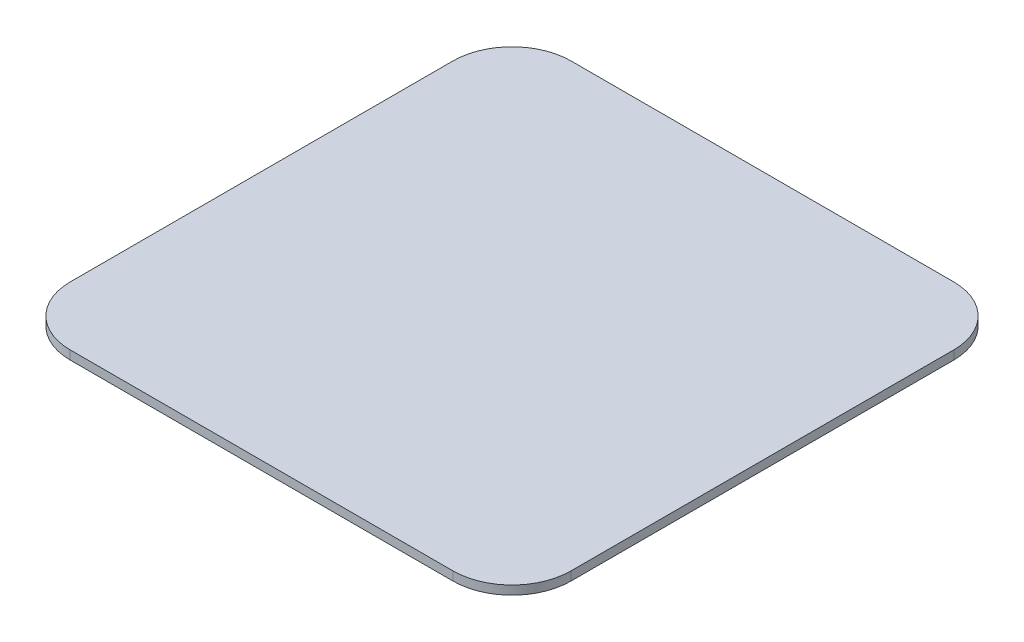
from build123d import *

# Parameters (mm, degrees)
SKETCH1_W           = 170
SKETCH1_H           = 170
BOSS_EXTRUDE4_DEPTH = 3
FILLET1_R           = 20


with BuildPart() as part:
    # Sketch1 → Boss-Extrude4 (new body)
    with BuildSketch(Plane(origin=(0, 0, 0), x_dir=(1, 0, 0), z_dir=(0, 1, 0))):
        Rectangle(SKETCH1_W, SKETCH1_H)
    extrude(amount=BOSS_EXTRUDE4_DEPTH)

    # Fillet1
    fillet1_edges = [part.edges().sort_by_distance(p)[0] for p in [
        (85, 1.5, 85),
        (-85, 1.5, 85),
        (-85, 1.5, -85),
        (85, 1.5, -85),
    ]]
    fillet(fillet1_edges, radius=FILLET1_R)


solid = part.part
